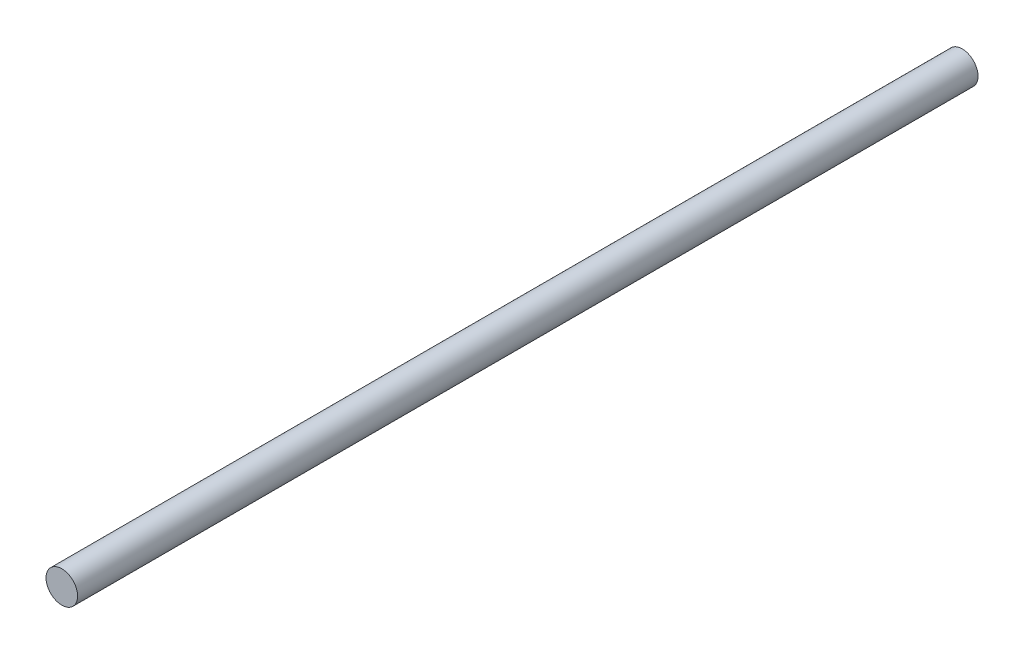
from build123d import *

# Parameters (mm, degrees)
VARILLA_START = -57
SK_VARILLA_R  = 2
VARILLA_DEPTH = 114


with BuildPart() as part:
    # Sk_Varilla → Varilla (new body)
    with BuildSketch(Plane.XY.offset(VARILLA_START)):
        with Locations(Location((0, 0, 0), (0, 0, 180))):
            Circle(SK_VARILLA_R)
    extrude(amount=VARILLA_DEPTH)


solid = part.part
